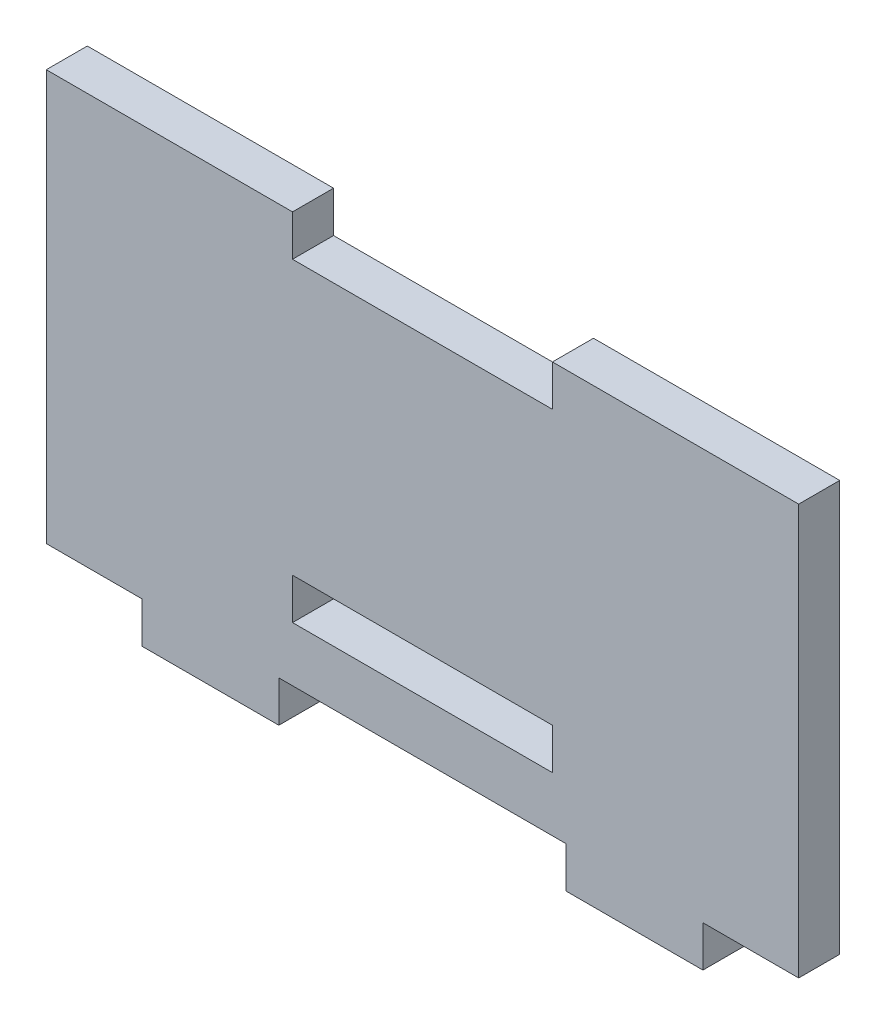
from build123d import *

# Parameters (mm, degrees)
SKETCH1_W           = 19
SKETCH1_H           = 3
BOSS_EXTRUDE1_DEPTH = 3


with BuildPart() as part:
    # Sketch1 → Boss-Extrude1 (new body)
    with BuildSketch(Plane.XY):
        Polygon((0, 0), (0, 30), (18, 30), (18, 27), (37, 27), (37, 30), (55, 30), (55, 0), (48, 0), (48, -3), (38, -3), (38, 0), (31, 0), (24, 0), (17, 0), (17, -3), (7, -3), (7, 0), align=None)
        with Locations((27.5, 5.5)):
            Rectangle(SKETCH1_W, SKETCH1_H, mode=Mode.SUBTRACT)
    extrude(amount=BOSS_EXTRUDE1_DEPTH)


solid = part.part
